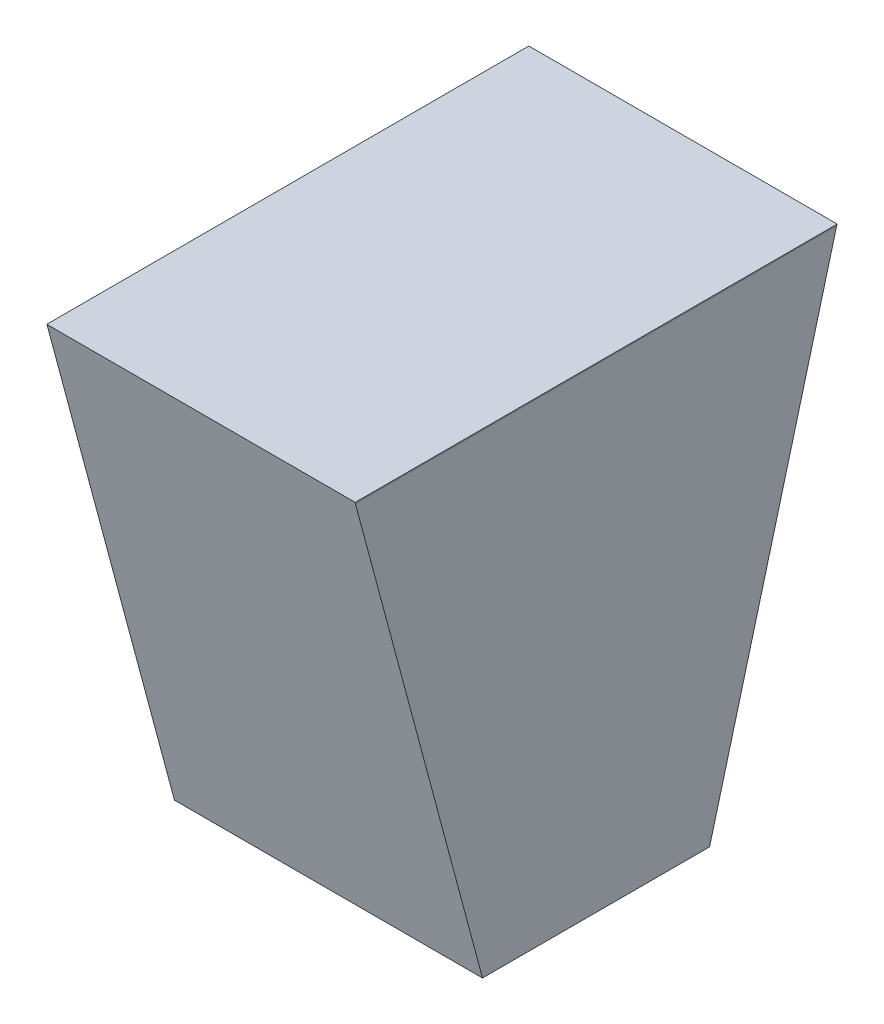
from build123d import *

# Parameters (mm, degrees)
SKETCH_TL_CUTTING_R    = 1.4986
TL_CUTTING_DEPTH       = 29.999999944
SKETCH_TDF_CUTTING_W   = 3.01719996
SKETCH_TDF_CUTTING_H   = 3.01719996
TDF_CUTTING_DEPTH      = 31.074766841
VW_VR_GRINDING_DEPTH   = 1.50859998
VW_VR_GRINDING_2_DEPTH = 1.50859998
ISA_GRINDING_DEPTH     = 1.50859998
SKETCH_PRE_FRX_BRX_W   = 1.21682002
SKETCH_PRE_FRX_BRX_H   = 0.83312
SKETCH_PRE_FRX_BRX_W_2 = 1.24935996
PRE_FRX_BRX_DEPTH      = 1.50859998
FA_BA_GRINDING_DEPTH   = 1.50859998


with BuildPart() as part:
    # sketch_TL_cutting → TL_cutting (new body)
    with BuildSketch(Plane(origin=(0, 0, 0), x_dir=(1, 0, 0), z_dir=(0, 1, 0))):
        with Locations(Location((0, 0, 0), (0, 0, 270))):
            Circle(SKETCH_TL_CUTTING_R)
    extrude(amount=TL_CUTTING_DEPTH)

    # sketch_TDF_cutting → TDF_cutting (cut, through all)
    with BuildSketch(Plane(origin=(0, 0, 0), x_dir=(1, 0, 0), z_dir=(0, 1, 0))):
        with Locations((-2.71001998, 0)):
            Rectangle(SKETCH_TDF_CUTTING_W, SKETCH_TDF_CUTTING_H)
    extrude(amount=TDF_CUTTING_DEPTH, mode=Mode.SUBTRACT)


with BuildPart() as body_2:
    # sketch_VW_VR_grinding → VW_VR_grinding (new, symmetric)
    with BuildSketch(Plane(origin=(0, 0, 0), x_dir=(0, 0, -1), z_dir=(1, 0, 0))):
        with BuildLine():
            Line((-1.49360001, -0.00999998), (-1.49360001, 0.822008914))
            ThreePointArc((-1.49360001, 0.822008914), (-1.493648337, 0.823115792), (-1.493792952, 0.824214246))
            Line((-1.493792952, 0.824214246), (-1.51859996, 0.964901782))
            Line((-1.51859996, 0.964901782), (-1.50859998, -0.00999998))
            Line((-1.50859998, -0.00999998), (-1.49360001, -0.00999998))
        make_face()
    extrude(amount=VW_VR_GRINDING_DEPTH, both=True)


with BuildPart() as body_3:
    # sketch_VW_VR_grinding → VW_VR_grinding 2 (new, symmetric)
    with BuildSketch(Plane(origin=(0, 0, 0), x_dir=(0, 0, -1), z_dir=(1, 0, 0))):
        with BuildLine():
            Line((1.49360001, -0.00999998), (1.49360001, 0.822008914))
            ThreePointArc((1.49360001, 0.822008914), (1.493648337, 0.823115792), (1.493792952, 0.824214246))
            Line((1.493792952, 0.824214246), (1.51859996, 0.964901782))
            Line((1.51859996, 0.964901782), (1.50859998, -0.00999998))
            Line((1.50859998, -0.00999998), (1.49360001, -0.00999998))
        make_face()
    extrude(amount=VW_VR_GRINDING_2_DEPTH, both=True)


    add(body_2.part)  # ISA_grinding merges body 2
    # sketch_ISA_grinding → ISA_grinding (add, symmetric)
    with BuildSketch(Plane(origin=(0, 0, 0), x_dir=(0, 0, -1), z_dir=(1, 0, 0))):
        Polygon((-0.19939, 0), (0.19939, 0), (1.50859998, 4.886038163), (1.50859998, -0.02999994), (-1.50859998, -0.02999994), (-1.50859998, 4.886038163), align=None)
    extrude(amount=ISA_GRINDING_DEPTH, both=True)

    # sketch_pre_FRX_BRX → pre_FRX_BRX (add, symmetric)
    with BuildSketch(Plane.XY):
        with Locations((0.89018999, 0.40656002)):
            Rectangle(SKETCH_PRE_FRX_BRX_W, SKETCH_PRE_FRX_BRX_H)
        with Locations((-0.89391998, 0.40656002)):
            Rectangle(SKETCH_PRE_FRX_BRX_W_2, SKETCH_PRE_FRX_BRX_H)
    extrude(amount=PRE_FRX_BRX_DEPTH, both=True)

    # sketch_FA_BA_grinding → FA_BA_grinding (add, symmetric)
    with BuildSketch(Plane.XY):
        Polygon((0.27178, -0.00999998), (0.27178, 0.83312), (1.6256, 10.466049838), (1.6256, -0.00999998), align=None)
        Polygon((-0.26924, -0.00999998), (-0.26924, 0.83312), (-1.32842, 8.369577303), (-1.32842, -0.00999998), align=None)
    extrude(amount=FA_BA_GRINDING_DEPTH, both=True)


with BuildPart() as part_1:
    add(part.part)

    # B1_fix: cut body 3
    add(body_3.part, mode=Mode.SUBTRACT)

    # SurfaceCut1
    split(bisect_by=Plane(origin=(0, 0.835526316, 0), x_dir=(1, 0, 0), z_dir=(0, 1, 0)), keep=Keep.BOTTOM)


solid = part_1.part
